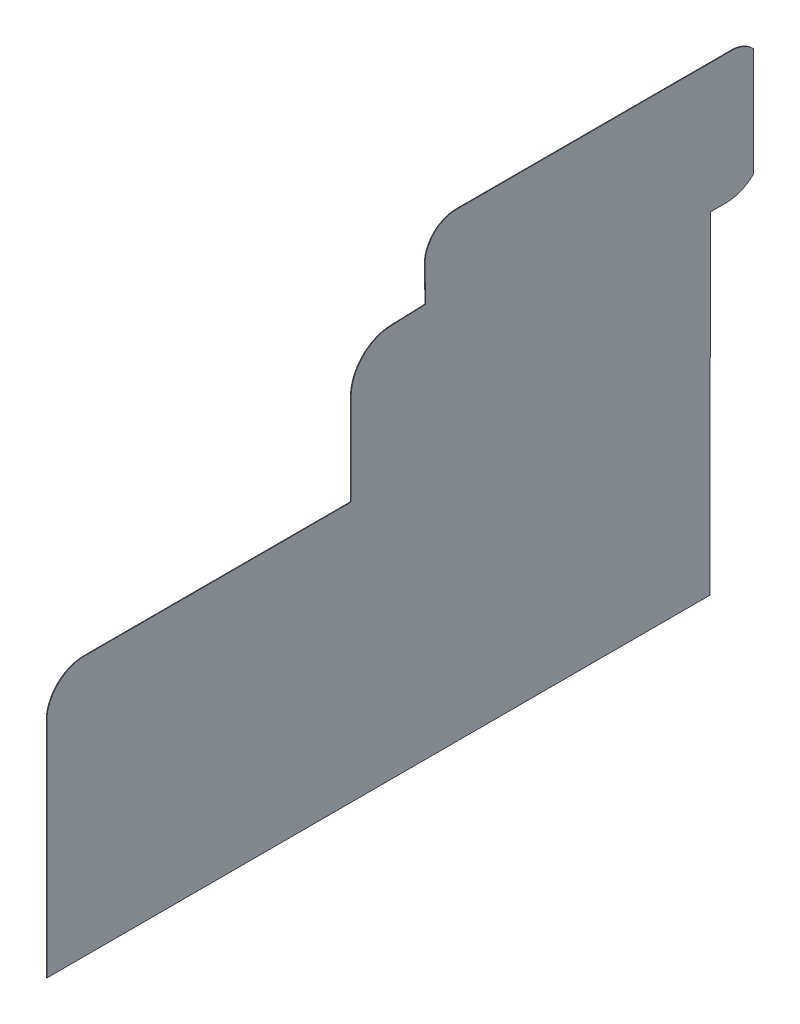
from build123d import *

# Parameters (mm, degrees)
ESTRUSIONE_ESTRUSIONE1_DEPTH = 0.001


with BuildPart() as part:
    # Schizzo1 → Estrusione-Estrusione1 (new body)
    with BuildSketch(Plane(origin=(0, 0, 0), x_dir=(0, 0, -1), z_dir=(1, 0, 0))):
        with BuildLine():
            Line((-0.071526265, 0.546624161), (-0.046068814, 0.546594381))
            ThreePointArc((-0.046068814, 0.546594381), (-0.02121057, 0.551458036), (-5.0908e-05, 0.565381258))
            Line((-5.0908e-05, 0.565381258), (-5.0908e-05, 0.743573522))
            ThreePointArc((-5.0908e-05, 0.743573522), (-0.016419009, 0.755414314), (-0.036182377, 0.759600997))
            Line((-0.036182377, 0.759600997), (-0.4895145, 0.759600997))
            ThreePointArc((-0.4895145, 0.759600997), (-0.528438366, 0.742303596), (-0.5416857, 0.701821804))
            Line((-0.5416857, 0.701821804), (-0.540899911, 0.649738789))
            Line((-0.540899911, 0.649738789), (-0.547244489, 0.649164557))
            Line((-0.547244489, 0.649164557), (-0.597514987, 0.647450149))
            ThreePointArc((-0.597514987, 0.647450149), (-0.644380755, 0.626618528), (-0.663602906, 0.579069968))
            Line((-0.663602906, 0.579069968), (-0.663602906, 0.428673119))
            Line((-0.663602906, 0.428673119), (-1.103080434, 0.428673119))
            ThreePointArc((-1.103080434, 0.428673119), (-1.144869962, 0.412520862), (-1.164932966, 0.372461706))
            Line((-1.164932966, 0.372461706), (-1.164932966, 4.5196e-05))
            Line((-1.164932966, 4.5196e-05), (-0.071963325, 4.5196e-05))
            Line((-0.071963325, 4.5196e-05), (-0.071526265, 0.546624161))
        make_face()
    extrude(amount=ESTRUSIONE_ESTRUSIONE1_DEPTH)


solid = part.part
